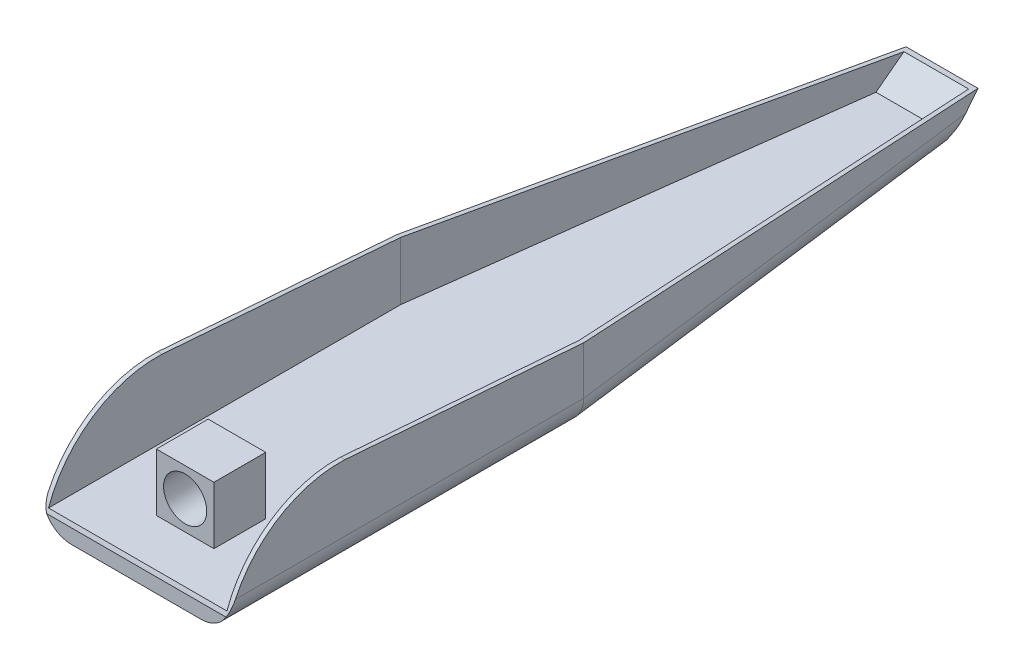
from build123d import *

# Parameters (mm, degrees)
BOSS_EXTRUDE1_DEPTH     = 65
CUT_EXTRUDE1_DEPTH      = 188.52539512587924
CUT_EXTRUDE1_DEPTH_BACK = 188.52539512587924
CUT_EXTRUDE2_DEPTH      = 188.52539512587933
CUT_EXTRUDE2_DEPTH_BACK = 188.52539512587933
SHELL2_T                = -1.5
BOSS_EXTRUDE2_DEPTH     = 20
SKETCH8_R               = 7.5
CUT_EXTRUDE3_DEPTH      = 20
BOSS_EXTRUDE4_DEPTH     = 5
FILLET12_R              = 10


with BuildPart() as part:
    # Sketch1 → Boss-Extrude1 (new body)
    with BuildSketch(Plane(origin=(0, 0, 0), x_dir=(0, 0, -1), z_dir=(1, 0, 0))):
        with BuildLine():
            Line((-106.35767816643843, 0), (163.6423218335616, 0))
            Line((163.6423218335616, 0), (173.6423218335616, 9.7979589711327))
            Line((173.6423218335616, 9.7979589711327), (-66.35767816643839, 28.050095))
            ThreePointArc((-66.35767816643839, 28.050095), (-91.13754828258394, 20.841238484230953), (-106.35767816643843, 0))
        make_face()
    extrude(amount=BOSS_EXTRUDE1_DEPTH)

    # Sketch3 → Cut-Extrude1 (cut, two sides: drawn at the far end of the back side and taken through both)
    with BuildSketch(Plane.XZ.offset(-CUT_EXTRUDE1_DEPTH_BACK)):
        Polygon((-72.93745664211396, 555.916712807033), (0, -16.642321833561624), (19.999999999999996, -173.6423218335616), (92.93745664211396, -746.2013564741562), (-1052.1806126390752, -892.0762697583841), (-1218.0555259233033, 410.04179952280515), align=None)
    extrude(amount=CUT_EXTRUDE1_DEPTH + CUT_EXTRUDE1_DEPTH_BACK, mode=Mode.SUBTRACT)

    # Sketch5 → Cut-Extrude2 (cut, two sides: drawn at the far end of the back side and taken through both)
    with BuildSketch(Plane.XZ.offset(-CUT_EXTRUDE2_DEPTH_BACK)):
        Polygon((137.93745664211394, 555.916712807033), (65, -16.64232183356158), (45, -173.6423218335616), (-27.937456642113958, -746.2013564741562), (1117.1806126390752, -892.0762697583841), (1283.0555259233033, 410.04179952280515), align=None)
    extrude(amount=CUT_EXTRUDE2_DEPTH + CUT_EXTRUDE2_DEPTH_BACK, mode=Mode.SUBTRACT)

    # Shell2
    shell2_openings = [part.faces().sort_by_distance(p)[0] for p in [
        (32.5, 20.220874291, -36.589887377),
        (32.5, 20.841238484, 91.137548283),
    ]]
    offset(amount=SHELL2_T, openings=shell2_openings, kind=Kind.INTERSECTION)

    # Sketch7 → Boss-Extrude2 (add)
    with BuildSketch(Plane(origin=(0, 1.5, 0), x_dir=(1, 0, 0), z_dir=(0, 1, 0))):
        Polygon((22.499999999999993, -71.3649853274635), (42.49999999999999, -71.3649853274635), (42.5, -89.36498532746351), (22.499999999999996, -89.36498532746351), align=None)
    extrude(amount=BOSS_EXTRUDE2_DEPTH)

    # Sketch8 → Cut-Extrude3 (cut)
    with BuildSketch(Plane.XY.offset(89.36498532746351)):
        with Locations((32.49999999999999, 11.500000000000002)):
            Circle(SKETCH8_R)
    extrude(amount=-CUT_EXTRUDE3_DEPTH, mode=Mode.SUBTRACT)

    # Sketch18 → Boss-Extrude4 (add)
    with BuildSketch(Plane.XZ):
        Polygon((65, 106.35767816643843), (0, 106.35767816643843), (0, -16.642321833561624), (18.726114649681534, -163.6423218335616), (46.27388535031847, -163.6423218335616), (65, -16.64232183356158), align=None)
    extrude(amount=BOSS_EXTRUDE4_DEPTH)

    # Fillet12
    fillet12_edges = [part.edges().sort_by_distance(p)[0] for p in [
        (65, -5, 44.857678166438426),
        (0, -5, 44.857678166438404),
        (9.363057324840767, -5, -90.14232183356161),
        (55.63694267515924, -5, -90.1423218335616),
    ]]
    fillet(fillet12_edges, radius=FILLET12_R)


solid = part.part
